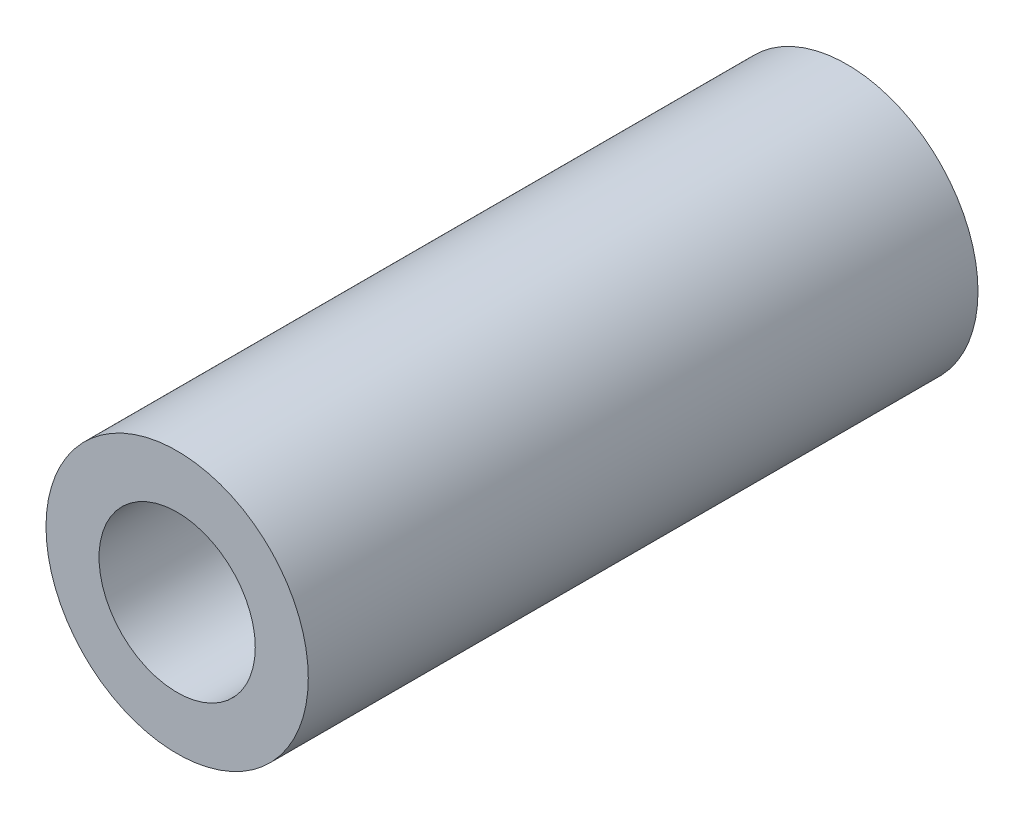
from build123d import *

# Parameters (mm, degrees)
SKETCH1_R   = 11.75
SKETCH1_R_2 = 7
PIN_DEPTH   = 30


with BuildPart() as part:
    # Sketch1 → Pin (new, symmetric)
    with BuildSketch(Plane.XY):
        Circle(SKETCH1_R)
        Circle(SKETCH1_R_2, mode=Mode.SUBTRACT)
    extrude(amount=PIN_DEPTH, both=True)


solid = part.part
